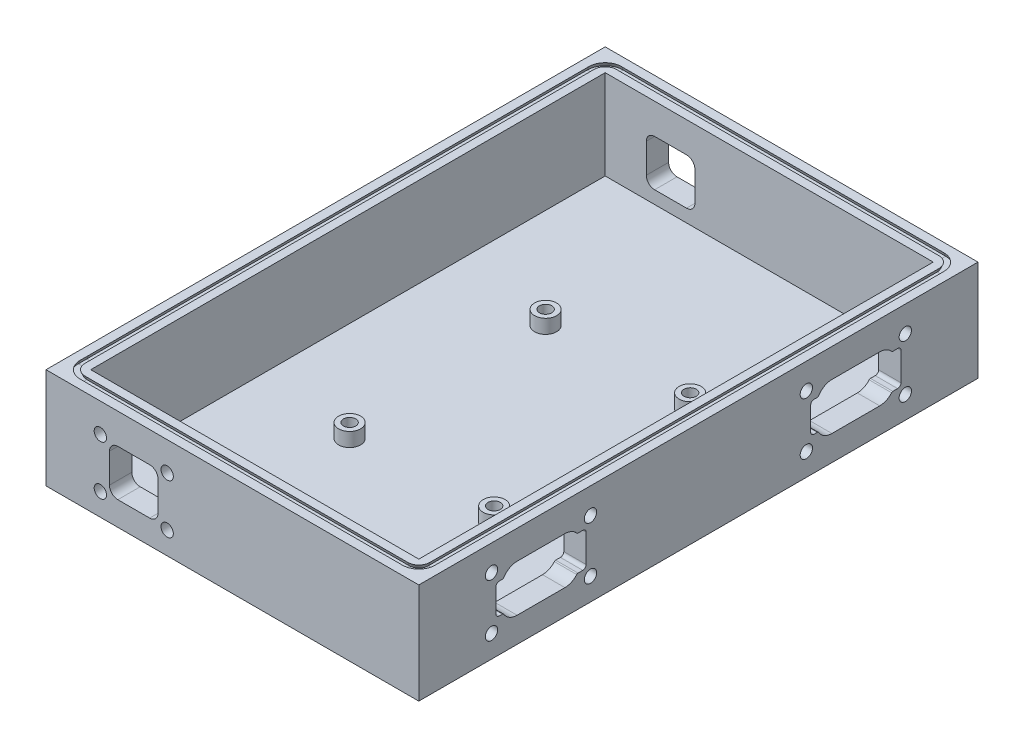
from build123d import *

# Parameters (mm, degrees)
SKETCH1_W           = 169.3418
SKETCH1_H           = 254
BOSS_EXTRUDE1_DEPTH = 45.72
SKETCH2_W           = 149.0218
SKETCH2_H           = 233.68
CUT_EXTRUDE1_DEPTH  = 40.64
CUT_EXTRUDE10_REACH = 310.679
F_12_PIN_MOUNT_R    = 2.7999944
CUT_EXTRUDE3_DEPTH  = 5.499989
CUT_EXTRUDE5_REACH  = 310.679
CUT_EXTRUDE6_START  = -254
CUT_EXTRUDE6_DEPTH  = 10.16
SKETCH6_R           = 2.7999944
CUT_EXTRUDE7_DEPTH  = 5.499989
CUT_EXTRUDE8_START  = -248.500011
SKETCH6_2_R         = 2.7999944
CUT_EXTRUDE8_DEPTH  = 5.499989
SKETCH7_R           = 5
BOSS_EXTRUDE2_DEPTH = 6.35
CUT_EXTRUDE9_START  = 6.35
SKETCH8_R           = 2.7999944
CUT_EXTRUDE9_DEPTH  = 5.499989


with BuildPart() as part:
    # Sketch1 → Boss-Extrude1 (new body)
    with BuildSketch(Plane(origin=(0, 0, 0), x_dir=(1, 0, 0), z_dir=(0, 1, 0))):
        with Locations((84.6709, 127)):
            Rectangle(SKETCH1_W, SKETCH1_H)
    extrude(amount=BOSS_EXTRUDE1_DEPTH)

    # Sketch2 → Cut-Extrude1 (cut)
    with BuildSketch(Plane(origin=(0, 45.72, 0), x_dir=(1, 0, 0), z_dir=(0, 1, 0))):
        with Locations((84.6709, 127)):
            Rectangle(SKETCH2_W, SKETCH2_H)
    extrude(amount=-CUT_EXTRUDE1_DEPTH, mode=Mode.SUBTRACT)

    # Cut-Sweep2: sweep along a path in Sketch3
    with BuildLine(Plane(origin=(0, 45.72, 0), x_dir=(1, 0, 0), z_dir=(0, 1, 0))) as cut_sweep2_path:
        Line((6.35, 11.43), (6.35, 242.57))
        ThreePointArc((6.35, 242.57), (7.837897552, 246.162102448), (11.43, 247.65))
        Line((11.43, 247.65), (157.9118, 247.65))
        ThreePointArc((157.9118, 247.65), (161.503902448, 246.162102448), (162.9918, 242.57))
        Line((162.9918, 242.57), (162.9918, 11.43))
        ThreePointArc((162.9918, 11.43), (161.503902448, 7.837897552), (157.9118, 6.35))
        Line((157.9118, 6.35), (11.43, 6.35))
        ThreePointArc((11.43, 6.35), (7.837897552, 7.837897552), (6.35, 11.43))
    # Sketch4 → Cut-Sweep2 (sweep, cut)
    with BuildSketch(Plane.XY.offset(-15.24)):
        Polygon((4.064, 45.72), (3.272383398, 43.942), (7.141616602, 43.942), (6.35, 45.72), align=None)
    sweep(path=cut_sweep2_path.line, mode=Mode.SUBTRACT)

    # Sketch13 → Cut-Extrude10 (cut, up to next)
    with BuildSketch(Plane(origin=(169.3418, 0, 0), x_dir=(0, 0, -1), z_dir=(1, 0, 0)), mode=Mode.PRIVATE) as cut_extrude10_sk1:
        with BuildLine():
            Line((37.955714122, 28.956), (36.5125, 28.956))
            ThreePointArc((36.5125, 28.956), (35.434869265, 28.509630735), (34.9885, 27.432))
            Line((34.9885, 27.432), (34.9885, 16.764))
            ThreePointArc((34.9885, 16.764), (35.434869265, 15.686369265), (36.5125, 15.24))
            Line((36.5125, 15.24), (37.955714122, 15.24))
            ThreePointArc((37.955714122, 15.24), (38.329218307, 15.142182673), (38.606829629, 14.873844156))
            ThreePointArc((38.606829629, 14.873844156), (41.179361214, 12.387240562), (44.6405, 11.4808))
            Line((44.6405, 11.4808), (66.3575, 11.4808))
            ThreePointArc((66.3575, 11.4808), (69.314150798, 12.129608753), (71.727465925, 13.956805195))
            ThreePointArc((71.727465925, 13.956805195), (71.987895615, 14.153984667), (72.306958651, 14.224))
            Line((72.306958651, 14.224), (74.4855, 14.224))
            ThreePointArc((74.4855, 14.224), (75.563130735, 14.670369265), (76.0095, 15.748))
            Line((76.0095, 15.748), (76.0095, 28.448))
            ThreePointArc((76.0095, 28.448), (75.563130735, 29.525630735), (74.4855, 29.972))
            Line((74.4855, 29.972), (72.306958651, 29.972))
            ThreePointArc((72.306958651, 29.972), (71.987895615, 30.042015333), (71.727465925, 30.239194805))
            ThreePointArc((71.727465925, 30.239194805), (69.314150798, 32.066391247), (66.3575, 32.7152))
            Line((66.3575, 32.7152), (44.6405, 32.7152))
            ThreePointArc((44.6405, 32.7152), (41.179361214, 31.808759438), (38.606829629, 29.322155844))
            ThreePointArc((38.606829629, 29.322155844), (38.329218307, 29.053817327), (37.955714122, 28.956))
        make_face()
    cut_extrude10_tool1 = extrude(cut_extrude10_sk1.sketch, amount=-CUT_EXTRUDE10_REACH, mode=Mode.PRIVATE) & part.part
    # Sketch13 → Cut-Extrude10 (cut, up to next)
    with BuildSketch(Plane(origin=(169.3418, 0, 0), x_dir=(0, 0, -1), z_dir=(1, 0, 0)), mode=Mode.PRIVATE) as cut_extrude10_sk2:
        with BuildLine():
            Line((180.957714122, 28.956), (179.5145, 28.956))
            ThreePointArc((179.5145, 28.956), (178.436869265, 28.509630735), (177.9905, 27.432))
            Line((177.9905, 27.432), (177.9905, 16.764))
            ThreePointArc((177.9905, 16.764), (178.436869265, 15.686369265), (179.5145, 15.24))
            Line((179.5145, 15.24), (180.957714122, 15.24))
            ThreePointArc((180.957714122, 15.24), (181.331218307, 15.142182673), (181.608829629, 14.873844156))
            ThreePointArc((181.608829629, 14.873844156), (184.181361214, 12.387240562), (187.6425, 11.4808))
            Line((187.6425, 11.4808), (209.3595, 11.4808))
            ThreePointArc((209.3595, 11.4808), (212.316150798, 12.129608753), (214.729465925, 13.956805195))
            ThreePointArc((214.729465925, 13.956805195), (214.989895615, 14.153984667), (215.308958651, 14.224))
            Line((215.308958651, 14.224), (217.4875, 14.224))
            ThreePointArc((217.4875, 14.224), (218.565130735, 14.670369265), (219.0115, 15.748))
            Line((219.0115, 15.748), (219.0115, 28.448))
            ThreePointArc((219.0115, 28.448), (218.565130735, 29.525630735), (217.4875, 29.972))
            Line((217.4875, 29.972), (215.308958651, 29.972))
            ThreePointArc((215.308958651, 29.972), (214.989895615, 30.042015333), (214.729465925, 30.239194805))
            ThreePointArc((214.729465925, 30.239194805), (212.316150798, 32.066391247), (209.3595, 32.7152))
            Line((209.3595, 32.7152), (187.6425, 32.7152))
            ThreePointArc((187.6425, 32.7152), (184.181361214, 31.808759438), (181.608829629, 29.322155844))
            ThreePointArc((181.608829629, 29.322155844), (181.331218307, 29.053817327), (180.957714122, 28.956))
        make_face()
    cut_extrude10_tool2 = extrude(cut_extrude10_sk2.sketch, amount=-CUT_EXTRUDE10_REACH, mode=Mode.PRIVATE) & part.part
    add(cut_extrude10_tool1.solids().sort_by_distance((169.3418, 22.098, -55.674803))[0], mode=Mode.SUBTRACT)
    add(cut_extrude10_tool2.solids().sort_by_distance((169.3418, 22.098, -198.676803))[0], mode=Mode.SUBTRACT)

    # 12 pin mount → Cut-Extrude3 (cut)
    with BuildSketch(Plane(origin=(169.3418, 0, 0), x_dir=(0, 0, -1), z_dir=(1, 0, 0))):
        with Locations((77.978, 34.036)):
            Circle(F_12_PIN_MOUNT_R)
        with Locations((77.978, 10.16)):
            Circle(F_12_PIN_MOUNT_R)
        with Locations((33.02, 10.16)):
            Circle(F_12_PIN_MOUNT_R)
        with Locations((33.02, 34.036)):
            Circle(F_12_PIN_MOUNT_R)
        with Locations((176.022, 34.036)):
            Circle(F_12_PIN_MOUNT_R)
        with Locations((220.98, 34.036)):
            Circle(F_12_PIN_MOUNT_R)
        with Locations((220.98, 10.16)):
            Circle(F_12_PIN_MOUNT_R)
        with Locations((176.022, 10.16)):
            Circle(F_12_PIN_MOUNT_R)
    extrude(amount=-CUT_EXTRUDE3_DEPTH, mode=Mode.SUBTRACT)

    # 4 pin connector → Cut-Extrude5 (cut, up to next)
    with BuildSketch(Plane.XY, mode=Mode.PRIVATE) as cut_extrude5_sk1:
        with BuildLine():
            Line((32.6263, 31.877), (47.1043, 31.877))
            ThreePointArc((47.1043, 31.877), (49.798376836, 30.761076836), (50.9143, 28.067))
            Line((50.9143, 28.067), (50.9143, 14.7066))
            ThreePointArc((50.9143, 14.7066), (49.798376836, 12.012523164), (47.1043, 10.8966))
            Line((47.1043, 10.8966), (32.6263, 10.8966))
            ThreePointArc((32.6263, 10.8966), (29.932223164, 12.012523164), (28.8163, 14.7066))
            Line((28.8163, 14.7066), (28.8163, 28.067))
            ThreePointArc((28.8163, 28.067), (29.932223164, 30.761076836), (32.6263, 31.877))
        make_face()
    cut_extrude5_tool1 = extrude(cut_extrude5_sk1.sketch, amount=-CUT_EXTRUDE5_REACH, mode=Mode.PRIVATE) & part.part
    add(cut_extrude5_tool1.solids().sort_by_distance((39.8653, 21.3868, 0))[0], mode=Mode.SUBTRACT)

    # Sketch5<2> → Cut-Extrude6 (cut)
    with BuildSketch(Plane.XY.offset(CUT_EXTRUDE6_START)):
        with BuildLine():
            Line((32.6263, 31.877), (47.1043, 31.877))
            ThreePointArc((47.1043, 31.877), (49.798376836, 30.761076836), (50.9143, 28.067))
            Line((50.9143, 28.067), (50.9143, 14.7066))
            ThreePointArc((50.9143, 14.7066), (49.798376836, 12.012523164), (47.1043, 10.8966))
            Line((47.1043, 10.8966), (32.6263, 10.8966))
            ThreePointArc((32.6263, 10.8966), (29.932223164, 12.012523164), (28.8163, 14.7066))
            Line((28.8163, 14.7066), (28.8163, 28.067))
            ThreePointArc((28.8163, 28.067), (29.932223164, 30.761076836), (32.6263, 31.877))
        make_face()
    extrude(amount=CUT_EXTRUDE6_DEPTH, mode=Mode.SUBTRACT)

    # Sketch6 → Cut-Extrude7 (cut)
    with BuildSketch(Plane.XY):
        with Locations((55.0418, 32.6136)):
            Circle(SKETCH6_R)
        with Locations((55.0418, 10.16)):
            Circle(SKETCH6_R)
        with Locations((24.6888, 10.16)):
            Circle(SKETCH6_R)
        with Locations((24.6888, 32.6136)):
            Circle(SKETCH6_R)
    extrude(amount=-CUT_EXTRUDE7_DEPTH, mode=Mode.SUBTRACT)

    # Sketch6<2> → Cut-Extrude8 (cut)
    with BuildSketch(Plane.XY.offset(CUT_EXTRUDE8_START)):
        with Locations((55.0418, 32.6136)):
            Circle(SKETCH6_2_R)
        with Locations((55.0418, 10.16)):
            Circle(SKETCH6_2_R)
        with Locations((24.6888, 10.16)):
            Circle(SKETCH6_2_R)
        with Locations((24.6888, 32.6136)):
            Circle(SKETCH6_2_R)
    extrude(amount=-CUT_EXTRUDE8_DEPTH, mode=Mode.SUBTRACT)

    # Sketch7 → Boss-Extrude2 (add)
    with BuildSketch(Plane(origin=(0, 5.08, 0), x_dir=(1, 0, 0), z_dir=(0, 1, 0))):
        with Locations(Location((55.4218, 82.485, 0), (0, 0, 90))):
            Circle(SKETCH7_R)
        with Locations(Location((121.0818, 82.485, 0), (0, 0, 90))):
            Circle(SKETCH7_R)
        with Locations(Location((121.0818, 171.515, 0), (0, 0, 90))):
            Circle(SKETCH7_R)
        with Locations(Location((55.4218, 171.515, 0), (0, 0, 90))):
            Circle(SKETCH7_R)
    extrude(amount=BOSS_EXTRUDE2_DEPTH)

    # Sketch8 → Cut-Extrude9 (cut)
    with BuildSketch(Plane(origin=(0, 5.08, 0), x_dir=(1, 0, 0), z_dir=(0, 1, 0)).offset(CUT_EXTRUDE9_START)):
        with Locations(Location((55.4218, 171.515, 0), (0, 0, 270))):
            Circle(SKETCH8_R)
        with Locations(Location((121.0818, 171.515, 0), (0, 0, 270))):
            Circle(SKETCH8_R)
        with Locations(Location((121.0818, 82.485, 0), (0, 0, 270))):
            Circle(SKETCH8_R)
        with Locations(Location((55.4218, 82.485, 0), (0, 0, 270))):
            Circle(SKETCH8_R)
    extrude(amount=-CUT_EXTRUDE9_DEPTH, mode=Mode.SUBTRACT)


solid = part.part
